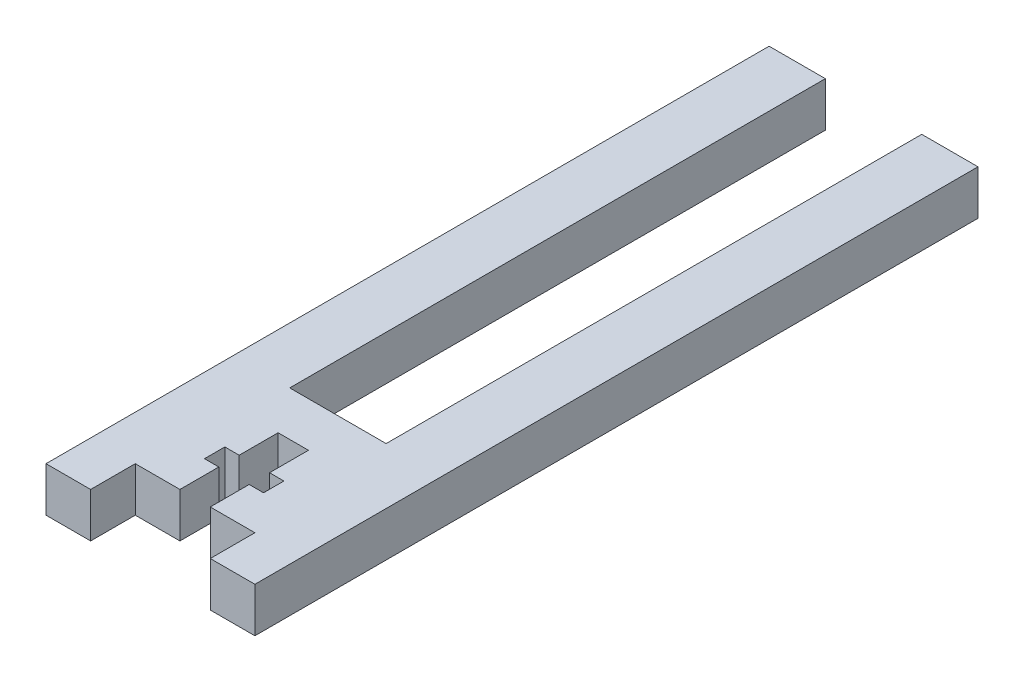
from build123d import *

# Parameters (mm, degrees)
BOSS_EXTRUDE1_DEPTH = 6.35


with BuildPart() as part:
    # Sketch1 → Boss-Extrude1 (new body)
    with BuildSketch(Plane(origin=(0, 0, 0), x_dir=(1, 0, 0), z_dir=(0, 1, 0))):
        Polygon((-6.858, 6.35), (-6.858, 82.55), (-14.859, 82.55), (-14.859, -13.97), (-14.859, -20.32), (-8.509, -20.32), (-8.509, -13.97), (-2.159, -13.97), (-2.159, -8.435000021), (-4.199999982, -8.435000021), (-4.199999982, -5.534999979), (-2.159, -5.534999979), (-2.159, 0), (2.159, 0), (2.159, -5.534999979), (4.199999982, -5.534999979), (4.199999982, -8.435000021), (2.159, -8.435000021), (2.159, -13.97), (8.509, -13.97), (8.509, -20.32), (14.859, -20.32), (14.859, -13.97), (14.859, 82.55), (6.858, 82.55), (6.858, 6.35), align=None)
    extrude(amount=BOSS_EXTRUDE1_DEPTH)


solid = part.part
